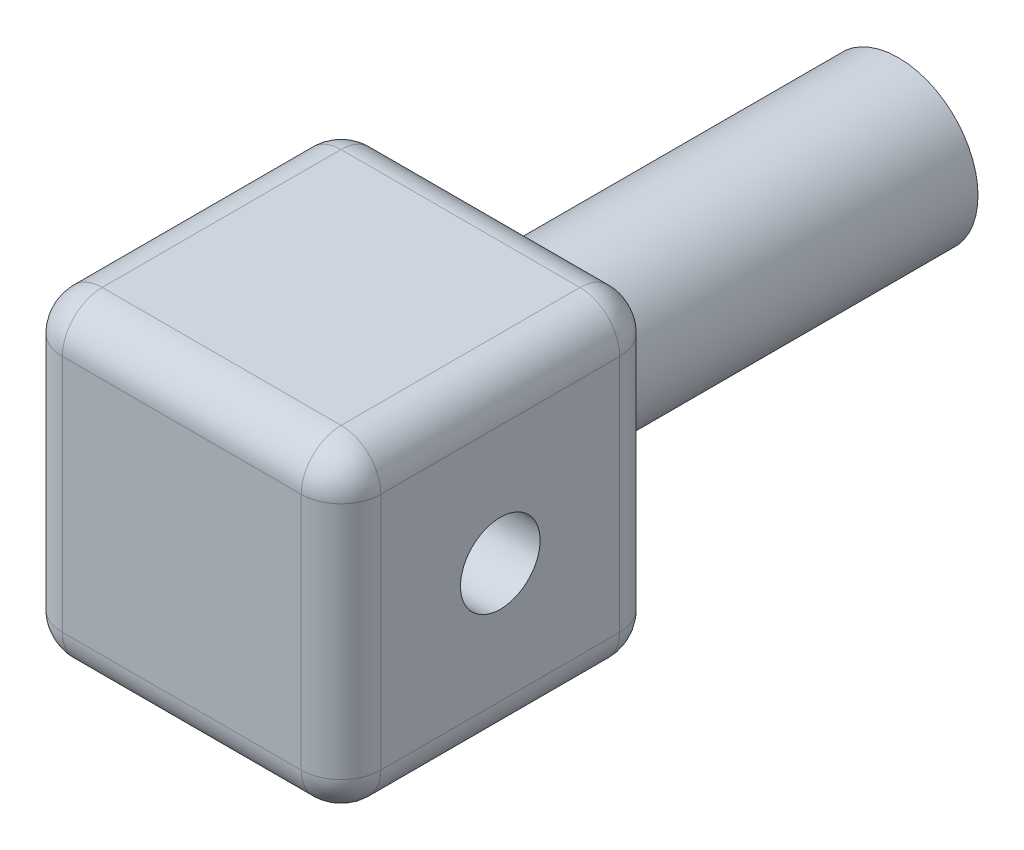
from build123d import *

# Parameters (mm, degrees)
BOX_SKETCH_W       = 80
BOX_SKETCH_H       = 80
BOX_EXTRUDE_DEPTH  = 80
BOX_FILLET_R       = 10
POLE_SKETCH_R      = 20
POLE_EXTRUDE_DEPTH = 100
HOLE_SKETCH_R      = 10
HOLE_CUT_DEPTH     = 80


with BuildPart() as part:
    # Box Sketch → Box Extrude (new body)
    with BuildSketch(Plane.XY):
        Rectangle(BOX_SKETCH_W, BOX_SKETCH_H)
    extrude(amount=BOX_EXTRUDE_DEPTH)

    # Box Fillet
    box_fillet_edges = [part.edges().sort_by_distance(p)[0] for p in [
        (-40, 0, 80),
        (0, -40, 80),
        (40, 0, 80),
        (0, -40, 0),
        (-40, 0, 0),
        (0, 40, 0),
        (40, 0, 0),
        (0, 40, 80),
        (40, -40, 40),
        (-40, -40, 40),
        (-40, 40, 40),
        (40, 40, 40),
    ]]
    fillet(box_fillet_edges, radius=BOX_FILLET_R)

    # Pole Sketch → Pole Extrude (add)
    with BuildSketch(Plane(origin=(0, 0, 0), x_dir=(-1, 0, 0), z_dir=(0, 0, -1))):
        with Locations(Location((0, 0, 0), (0, 0, 180))):
            Circle(POLE_SKETCH_R)
    extrude(amount=POLE_EXTRUDE_DEPTH)

    # Hole Sketch → Hole Cut (cut)
    with BuildSketch(Plane.ZY.offset(40)):
        with Locations(Location((40, 0, 0), (0, 0, 270))):
            Circle(HOLE_SKETCH_R)
    extrude(amount=-HOLE_CUT_DEPTH, mode=Mode.SUBTRACT)


solid = part.part
